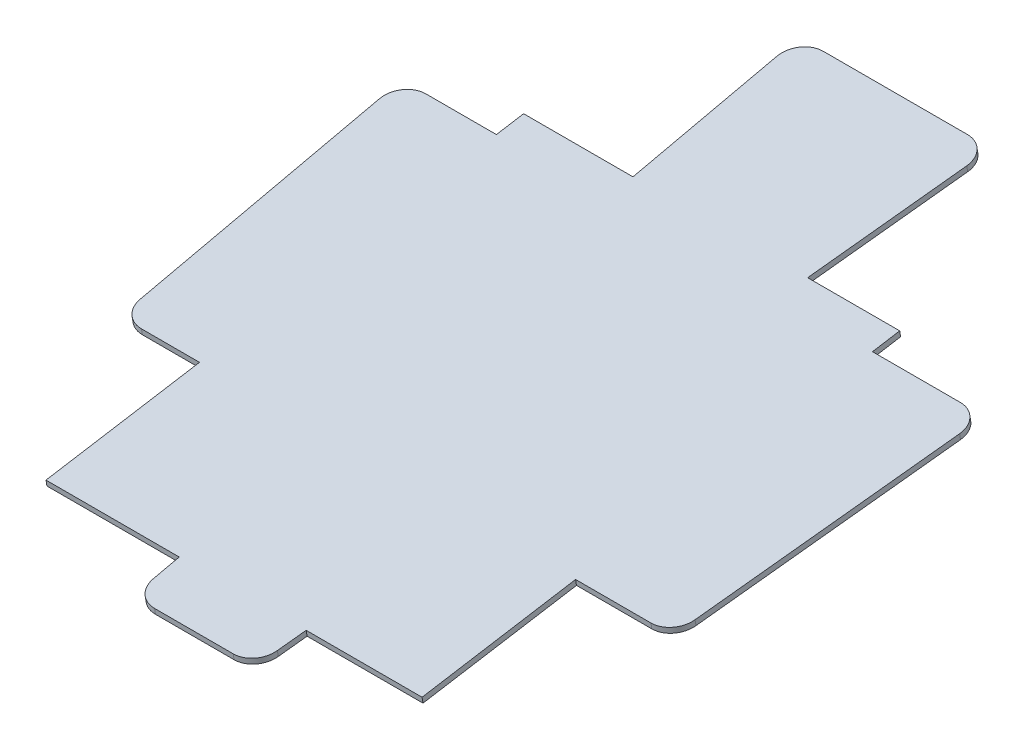
from build123d import *

# Parameters (mm, degrees)
BOSS_EXTRUDE1_DEPTH = 3.175
FILLET1_R           = 12.7


with BuildPart() as part:
    # Sketch2 → Boss-Extrude1 (new body)
    with BuildSketch(Plane(origin=(0, 631.882105473, 103.848248331), x_dir=(1, 0, 0), z_dir=(0, 0.9867625124381899, 0.16217195826243017))):
        Polygon((100, -1224.067157157), (100, -1137.347457675), (154.094451659, -1137.347457675), (162.370253897, -969.61100369), (100, -969.61100369), (100, -954.242157057), (48.689491118, -954.242157057), (53.570568791, -855.31100369), (-53.570568791, -855.31100369), (-48.689491118, -954.242157057), (-100, -954.242157057), (-109.652, -954.242157057), (-109.652, -969.61100369), (-162.370253897, -969.61100369), (-154.094451659, -1137.347457675), (-109.652, -1137.347457675), (-109.652, -1224.067157157), (-100, -1224.067157157), (-35.376831367, -1224.067157157), (-34.016071035, -1251.647457675), (34.016071035, -1251.647457675), (35.376831367, -1224.067157157), align=None)
    extrude(amount=-BOSS_EXTRUDE1_DEPTH)

    # Fillet1
    fillet1_edges = [part.edges().sort_by_distance(p)[0] for p in [
        (34.016071035, 427.333500719, 1338.66959037),
        (-34.016071035, 427.333500719, 1338.66959037),
        (-154.094451659, 445.869755548, 1225.882635198),
        (-162.370253897, 473.071904763, 1060.366590436),
        (-53.570568791, 491.608159593, 947.579635264),
        (53.570568791, 491.608159593, 947.579635264),
        (162.370253897, 473.071904763, 1060.366590436),
        (154.094451659, 445.869755548, 1225.882635198),
    ]]
    fillet(fillet1_edges, radius=FILLET1_R)


solid = part.part
